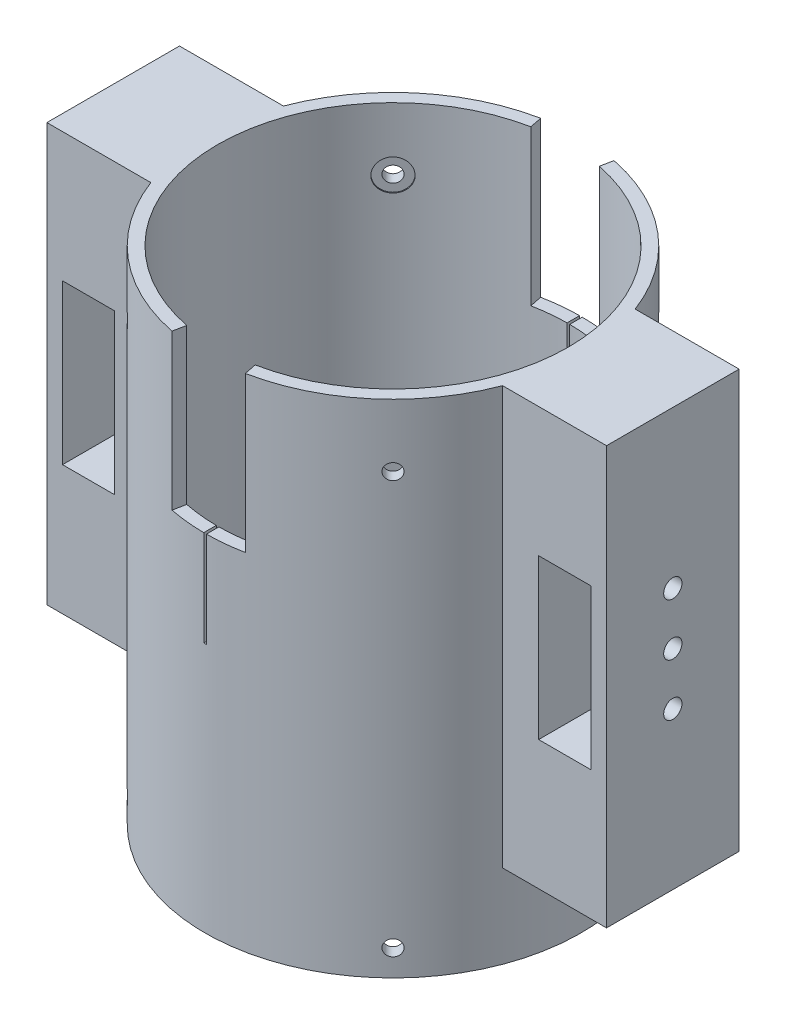
from build123d import *

# Parameters (mm, degrees)
SKETCH1_R                = 33.6
BOSS_EXTRUDE2_DEPTH      = 80
CUT_EXTRUDE3_DEPTH       = 103.805447326
CUT_EXTRUDE3_DEPTH_BACK  = 29.7
CUT_EXTRUDE4_DEPTH       = 103.805447326
CUT_EXTRUDE4_DEPTH_BACK  = 103.805447326
SKETCH7_W                = 0.5
SKETCH7_H                = 18.3
SKETCH9_W                = 10
SKETCH9_H                = 30.5
CUT_EXTRUDE5_DEPTH       = 108.910379482
SKETCH10_R               = 1.75
CUT_EXTRUDE6_DEPTH       = 10
BOSS_EXTRUDE3_REACH      = 120.799
BOSS_EXTRUDE3_END_RADIUS = 33.6
SKETCH11_R               = 3
SKETCH12_R               = 3
CUT_EXTRUDE7_DEPTH       = 10.2
SKETCH13_R               = 1.5
CUT_EXTRUDE9_DEPTH       = 119.798640203
CIRPATTERN1_COUNT        = 4
BOSS_EXTRUDE4_START      = 16
SKETCH14_R               = 36
SKETCH14_R_2             = 33.6
BOSS_EXTRUDE4_DEPTH      = 16
SKETCH17_R               = 1.5
CUT_EXTRUDE10_DEPTH      = 103.805447439
CIRPATTERN2_COUNT        = 4


with BuildPart() as part:
    # Sketch1 → Boss-Extrude2 (new body)
    with BuildSketch(Plane(origin=(0, 0, 0), x_dir=(1, 0, 0), z_dir=(0, 1, 0))):
        with BuildLine():
            ThreePointArc((33.685456803, 12.7), (0, 36), (-33.685456803, 12.7))
            Line((-33.685456803, 12.7), (-53.6, 12.7))
            Line((-53.6, 12.7), (-53.6, -12.7))
            Line((-53.6, -12.7), (-33.685456803, -12.7))
            ThreePointArc((-33.685456803, -12.7), (0, -36), (33.685456803, -12.7))
            Line((33.685456803, -12.7), (53.6, -12.7))
            Line((53.6, -12.7), (53.6, 12.7))
            Line((53.6, 12.7), (33.685456803, 12.7))
        make_face()
        with Locations(Location((0, 0, 0), (0, 0, 270))):
            Circle(SKETCH1_R, mode=Mode.SUBTRACT)
    extrude(amount=BOSS_EXTRUDE2_DEPTH)

    # Sketch6 → Cut-Extrude3 (cut, two sides: drawn at the far end of the back side and taken through both)
    with BuildSketch(Plane(origin=(0, 80, 0), x_dir=(1, 0, 0), z_dir=(0, 1, 0)).offset(-CUT_EXTRUDE3_DEPTH_BACK)):
        with BuildLine():
            Line((-7.023251593, 35.308270095), (-6.55503482, 32.954385422))
            ThreePointArc((-6.55503482, 32.954385422), (0, 33.6), (6.55503482, 32.954385422))
            Line((6.55503482, 32.954385422), (7.023251593, 35.308270095))
            ThreePointArc((7.023251593, 35.308270095), (0, 36), (-7.023251593, 35.308270095))
        make_face()
        with BuildLine():
            Line((-7.023251593, -35.308270095), (-6.55503482, -32.954385422))
            ThreePointArc((-6.55503482, -32.954385422), (0, -33.6), (6.55503482, -32.954385422))
            Line((6.55503482, -32.954385422), (7.023251593, -35.308270095))
            ThreePointArc((7.023251593, -35.308270095), (0, -36), (-7.023251593, -35.308270095))
        make_face()
    extrude(amount=CUT_EXTRUDE3_DEPTH + CUT_EXTRUDE3_DEPTH_BACK, mode=Mode.SUBTRACT)

    # Sketch7 → Cut-Extrude4 (cut, two sides: drawn at the far end of the back side and taken through both)
    with BuildSketch(Plane.XY.offset(-CUT_EXTRUDE4_DEPTH_BACK)):
        with Locations((0, 41.15)):
            Rectangle(SKETCH7_W, SKETCH7_H)
    extrude(amount=CUT_EXTRUDE4_DEPTH + CUT_EXTRUDE4_DEPTH_BACK, mode=Mode.SUBTRACT)

    # Sketch9 → Cut-Extrude5 (cut, through all)
    with BuildSketch(Plane.XY.offset(12.7)):
        with Locations((-45.6, 40)):
            Rectangle(SKETCH9_W, SKETCH9_H)
        with Locations((45.6, 40)):
            Rectangle(SKETCH9_W, SKETCH9_H)
    extrude(amount=-CUT_EXTRUDE5_DEPTH, mode=Mode.SUBTRACT)

    # Sketch10 → Cut-Extrude6 (cut)
    with BuildSketch(Plane.ZY.offset(53.6)):
        with Locations((0, 40)):
            Circle(SKETCH10_R)
        with Locations((0, 50)):
            Circle(SKETCH10_R)
        with Locations((0, 30)):
            Circle(SKETCH10_R)
    cut_extrude6 = extrude(amount=-CUT_EXTRUDE6_DEPTH, mode=Mode.SUBTRACT)

    # Mirror1: Cut-Extrude6 across plane
    add(cut_extrude6.mirror(Plane(origin=(0, 0, 0), x_dir=(0, 0, 1), z_dir=(1, 0, 0))), mode=Mode.SUBTRACT)

    # Boss-Extrude3: up to this cylinder (the profile starts inside it)
    boss_extrude3_end = Plane(origin=(0, 68, 0), z_dir=(0, -1, 0)) * Cylinder(BOSS_EXTRUDE3_END_RADIUS, 309.798, mode=Mode.PRIVATE)
    # Sketch11 → Boss-Extrude3 (add, up to the surface)
    with BuildSketch(Plane(origin=(16.674534964, 0, 16.674534964), x_dir=(0, 1, 0), z_dir=(0.7071067811865488, 0, 0.7071067811865464)), mode=Mode.PRIVATE) as boss_extrude3_sk1:
        with Locations(Location((68, 0, 0), (0, 0, 90))):
            Circle(SKETCH11_R)
    boss_extrude3_tool1 = extrude(boss_extrude3_sk1.sketch, amount=BOSS_EXTRUDE3_REACH, mode=Mode.PRIVATE) & boss_extrude3_end
    boss_extrude3 = boss_extrude3_tool1.solids().sort_by_distance((16.674535, 68, 16.674535))[0]
    add(boss_extrude3)

    # Sketch12 → Cut-Extrude7 (cut)
    with BuildSketch(Plane(origin=(16.674534964, 0, 16.674534964), x_dir=(-0.7071067811865465, 0, 0.7071067811865487), z_dir=(-0.7071067811865487, 0, -0.7071067811865465))):
        with Locations((0, 68)):
            Circle(SKETCH12_R)
    cut_extrude7 = extrude(amount=-CUT_EXTRUDE7_DEPTH, mode=Mode.SUBTRACT)

    # Sketch13 → Cut-Extrude9 (cut, through all)
    with BuildSketch(Plane(origin=(16.674534964, 0, 16.674534964), x_dir=(0, 1, 0), z_dir=(0.7071067811865488, 0, 0.7071067811865464))):
        with Locations(Location((68, 0, 0), (0, 0, 90))):
            Circle(SKETCH13_R)
    cut_extrude9 = extrude(amount=CUT_EXTRUDE9_DEPTH, mode=Mode.SUBTRACT)

    # CirPattern1: Boss-Extrude3, Cut-Extrude7, Cut-Extrude9 ×4 about axis
    cirpattern1_axis = Axis((0, 0, 0), (0, 1, 0))
    add([boss_extrude3.rotate(cirpattern1_axis, i * 360 / CIRPATTERN1_COUNT) for i in range(1, CIRPATTERN1_COUNT)])
    add([cut_extrude7.rotate(cirpattern1_axis, i * 360 / CIRPATTERN1_COUNT) for i in range(1, CIRPATTERN1_COUNT)], mode=Mode.SUBTRACT)
    add([cut_extrude9.rotate(cirpattern1_axis, i * 360 / CIRPATTERN1_COUNT) for i in range(1, CIRPATTERN1_COUNT)], mode=Mode.SUBTRACT)

    # Sketch14 → Boss-Extrude4 (add)
    with BuildSketch(Plane.XZ.offset(BOSS_EXTRUDE4_START)):
        with Locations(Location((0, 0, 0), (0, 0, 270))):
            Circle(SKETCH14_R)
        with Locations(Location((0, 0, 0), (0, 0, 270))):
            Circle(SKETCH14_R_2, mode=Mode.SUBTRACT)
    extrude(amount=-BOSS_EXTRUDE4_DEPTH)

    # Sketch17 → Cut-Extrude10 (cut, through all)
    with BuildSketch(Plane(origin=(0, 0, 0), x_dir=(0, 1, 0), z_dir=(0.7071067811865488, 0, 0.7071067811865464))):
        with Locations(Location((-11, 0, 0), (0, 0, 270))):
            Circle(SKETCH17_R)
    cut_extrude10 = extrude(amount=-CUT_EXTRUDE10_DEPTH, mode=Mode.SUBTRACT)

    # CirPattern2: Cut-Extrude10 ×4 about axis
    cirpattern2_axis = Axis((0, 80, 0), (0, -1, 0))
    for i in range(1, CIRPATTERN2_COUNT):
        add(cut_extrude10.rotate(cirpattern2_axis, i * 360 / CIRPATTERN2_COUNT), mode=Mode.SUBTRACT)


solid = part.part
